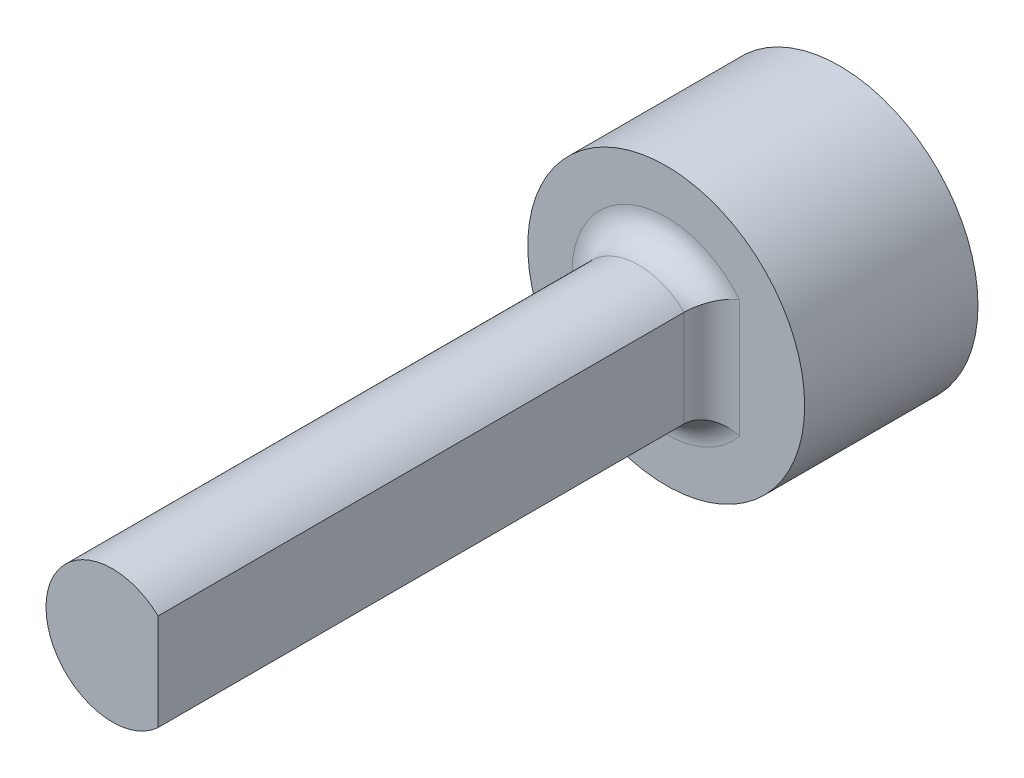
from build123d import *

# Parameters (mm, degrees)
BOSS_EXTRUDE1_DEPTH   = 6.1722
SKETCH1_R             = 6.35
SKETCH1_R_2           = 4.7498
BOSS_EXTRUDE1_2_DEPTH = 6.1722
SKETCH2_R             = 6.35
BOSS_EXTRUDE2_DEPTH   = 1.778
SKETCH3_R             = 3.048
BOSS_EXTRUDE3_DEPTH   = 25.4
CUT_EXTRUDE1_START    = -25.4
CUT_EXTRUDE1_DEPTH    = 25.4
FILLET1_R             = 1.27
CUT_EXTRUDE2_DEPTH    = 2.54


with BuildPart() as part:
    # Sketch1 → Boss-Extrude1 (new body)
    with BuildSketch(Plane.XY):
        Polygon((-2.413, 1.3931462), (-2.413, -1.3931462), (0, -2.786292399), (2.413, -1.3931462), (2.413, 1.3931462), (0, 2.786292399), align=None)
    extrude(amount=BOSS_EXTRUDE1_DEPTH)



with BuildPart() as body_2:
    # Sketch1 → Boss-Extrude1 2 (new body)
    with BuildSketch(Plane.XY):
        Circle(SKETCH1_R)
        Circle(SKETCH1_R_2, mode=Mode.SUBTRACT)
    extrude(amount=BOSS_EXTRUDE1_2_DEPTH)


with BuildPart() as part_1:
    add(part.part)

    add(body_2.part)  # Boss-Extrude2 merges body 2
    # Sketch2 → Boss-Extrude2 (add)
    with BuildSketch(Plane.XY.offset(6.1722)):
        Circle(SKETCH2_R)
    extrude(amount=BOSS_EXTRUDE2_DEPTH)

    # Sketch3 → Boss-Extrude3 (add)
    with BuildSketch(Plane.XY.offset(7.9502)):
        with Locations(Location((0, 0, 0), (0, 0, 180))):
            Circle(SKETCH3_R)
    extrude(amount=BOSS_EXTRUDE3_DEPTH)

    # Sketch4 → Cut-Extrude1 (cut)
    with BuildSketch(Plane.XY.offset(33.3502).offset(CUT_EXTRUDE1_START)):
        with BuildLine():
            Line((2.093142983, 2.215639062), (2.093142983, -2.215639062))
            ThreePointArc((2.093142983, -2.215639062), (3.048, 0), (2.093142983, 2.215639062))
        make_face()
    extrude(amount=CUT_EXTRUDE1_DEPTH, mode=Mode.SUBTRACT)

    # Fillet1
    fillet1_edges = [part_1.edges().sort_by_distance(p)[0] for p in [
        (-3.048, 0, 7.9502),
        (2.093142983, 0, 7.9502),
    ]]
    fillet(fillet1_edges, radius=FILLET1_R)

    # Sketch5 → Cut-Extrude2 (cut)
    with BuildSketch(Plane(origin=(0, 0, 0), x_dir=(-1, 0, 0), z_dir=(0, 0, -1))):
        Polygon((2.413, -1.3931462), (2.413, 1.3931462), (0, 2.786292399), (-2.413, 1.3931462), (-2.413, -1.3931462), (0, -2.786292399), align=None)
    extrude(amount=-CUT_EXTRUDE2_DEPTH, mode=Mode.SUBTRACT)


solid = part_1.part
